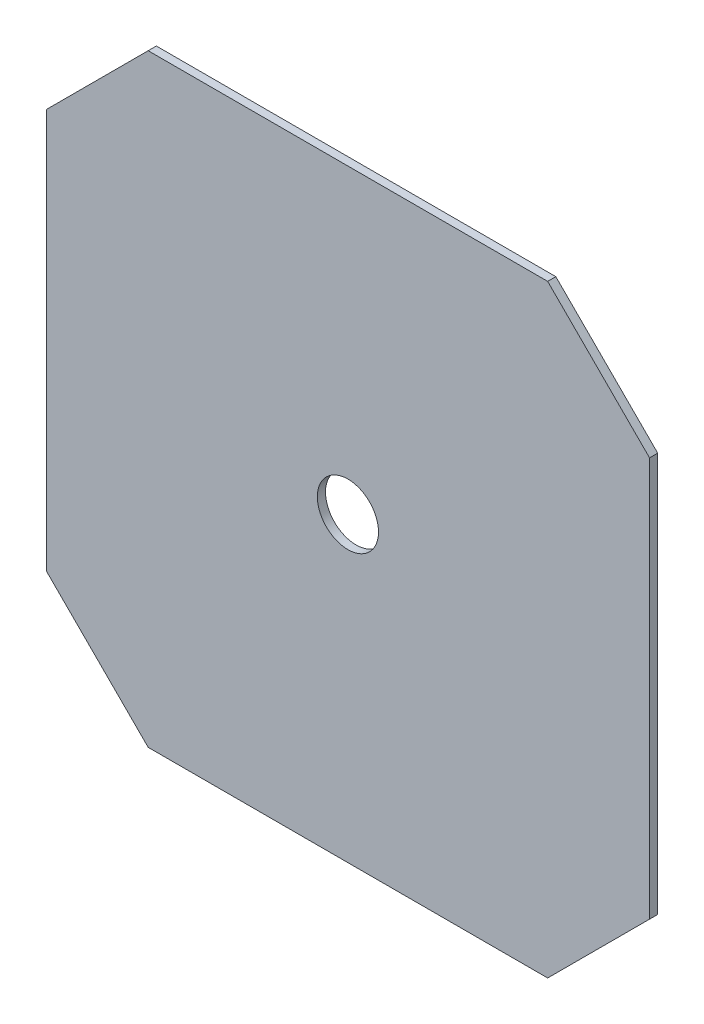
from build123d import *

# Parameters (mm, degrees)
BOSS_EXTRUDE1_DEPTH = 2
SKETCH2_R           = 7.5
CUT_EXTRUDE1_DEPTH  = 10


with BuildPart() as part:
    # Sketch1 → Boss-Extrude1 (new body)
    with BuildSketch(Plane.XY):
        Polygon((-74, 49), (-49, 74), (49, 74), (74, 49), (74, -49), (49, -74), (-49, -74), (-74, -49), align=None)
    extrude(amount=BOSS_EXTRUDE1_DEPTH)

    # Sketch2 → Cut-Extrude1 (cut)
    with BuildSketch(Plane.XY.offset(2)):
        Circle(SKETCH2_R)
    extrude(amount=-CUT_EXTRUDE1_DEPTH, mode=Mode.SUBTRACT)


solid = part.part
